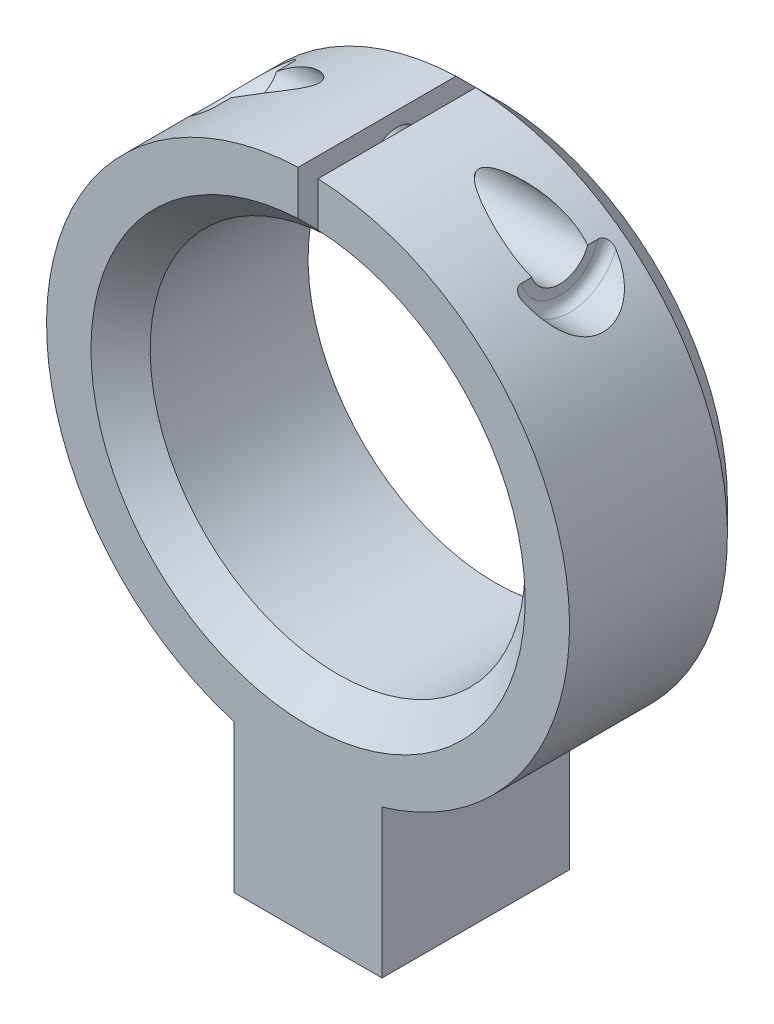
from build123d import *

# Parameters (mm, degrees)
BOSS_EXTRUDE1_DEPTH     = 16
SKETCH2_R               = 3.05
CUT_EXTRUDE1_DEPTH      = 15
BOSS_EXTRUDE2_DEPTH     = 3
CHAMFER4_SIZE           = 3
CUT_EXTRUDE2_DEPTH      = 29
CUT_EXTRUDE2_DEPTH_BACK = 25
SKETCH4_R               = 1.5
SKETCH5_R               = 2.5
CUT_EXTRUDE3_DEPTH      = 27.5
SKETCH6_R               = 3
CUT_EXTRUDE4_DEPTH      = 22.5
SKETCH5_3_R             = 5
SKETCH5_3_R_2           = 2.5
CUT_EXTRUDE5_DEPTH      = 11
SKETCH6_3_R             = 5
SKETCH6_3_R_2           = 3
CUT_EXTRUDE6_DEPTH      = 11
FILLET1_R               = 1


with BuildPart() as part:
    # Sketch1 → Boss-Extrude1 (new body)
    with BuildSketch(Plane.XY):
        with BuildLine():
            ThreePointArc((-14.719179189, 28.233250262), (-15.719179189, -9.740415699), (-16.719179189, 28.233250262))
            Line((-16.719179189, 28.233250262), (-16.719179189, 35.740709655))
            ThreePointArc((-16.719179189, 35.740709655), (-42.013744392, 12.552886715), (-23.219179189, -16.156945753))
            Line((-23.219179189, -16.156945753), (-23.219179189, -31.156945753))
            Line((-23.219179189, -31.156945753), (-8.219179189, -31.156945753))
            Line((-8.219179189, -31.156945753), (-8.219179189, -16.156945753))
            ThreePointArc((-8.219179189, -16.156945753), (10.575386014, 12.552886715), (-14.719179189, 35.740709655))
            Line((-14.719179189, 35.740709655), (-14.719179189, 28.233250262))
        make_face()
    extrude(amount=BOSS_EXTRUDE1_DEPTH)

    # Sketch2 → Cut-Extrude1 (cut)
    with BuildSketch(Plane.XZ.offset(31.156945753)):
        with Locations(Location((-15.719179189, 8.5, 0), (0, 0, 270))):
            Circle(SKETCH2_R)
    extrude(amount=-CUT_EXTRUDE1_DEPTH, mode=Mode.SUBTRACT)

    # Sketch3 → Boss-Extrude2 (add)
    with BuildSketch(Plane.XY.offset(16)):
        with BuildLine():
            ThreePointArc((-14.719179189, 28.233250262), (-15.719179189, -9.740415699), (-16.719179189, 28.233250262))
            Line((-16.719179189, 28.233250262), (-16.719179189, 35.740709655))
            ThreePointArc((-16.719179189, 35.740709655), (-42.013744392, 12.552886715), (-23.219179189, -16.156945753))
            Line((-23.219179189, -16.156945753), (-23.219179189, -31.156945753))
            Line((-23.219179189, -31.156945753), (-8.219179189, -31.156945753))
            Line((-8.219179189, -31.156945753), (-8.219179189, -16.156945753))
            ThreePointArc((-8.219179189, -16.156945753), (10.575386014, 12.552886715), (-14.719179189, 35.740709655))
            Line((-14.719179189, 35.740709655), (-14.719179189, 28.233250262))
        make_face()
    extrude(amount=BOSS_EXTRUDE2_DEPTH)

    # Chamfer4
    chamfer4_edges = [part.edges().sort_by_distance(p)[0] for p in [
        (-15.719179189, -9.740415699, 19),
        (10.575386014, 12.552886715, 0),
        (-42.013744392, 12.552886715, 0),
    ]]
    chamfer(chamfer4_edges, length=CHAMFER4_SIZE)

    # Sketch4 → Cut-Extrude2 (cut, two sides: drawn at the far end of the back side and taken through both)
    with BuildSketch(Plane.ZY.offset(14.719179189).offset(-CUT_EXTRUDE2_DEPTH_BACK)):
        with Locations(Location((9, 31.740709655, 0), (0, 0, 180))):
            Circle(SKETCH4_R)
    extrude(amount=CUT_EXTRUDE2_DEPTH + CUT_EXTRUDE2_DEPTH_BACK, mode=Mode.SUBTRACT)

    # Sketch5 → Cut-Extrude3 (cut)
    with BuildSketch(Plane.ZY.offset(42.219179189)):
        with Locations((9, 31.740709655)):
            Circle(SKETCH5_R)
    extrude(amount=-CUT_EXTRUDE3_DEPTH, mode=Mode.SUBTRACT)

    # Sketch6 → Cut-Extrude4 (cut)
    with BuildSketch(Plane(origin=(10.780820811, 0, 0), x_dir=(0, 0, -1), z_dir=(1, 0, 0))):
        with Locations((-9, 31.740709655)):
            Circle(SKETCH6_R)
    extrude(amount=-CUT_EXTRUDE4_DEPTH, mode=Mode.SUBTRACT)

    # Sketch5<3> → Cut-Extrude5 (cut)
    with BuildSketch(Plane.ZY.offset(42.219179189)):
        with Locations((9, 31.740709655)):
            Circle(SKETCH5_3_R)
        with Locations(Location((9, 31.740709655, 0), (0, 0, 336.747995985))):
            Circle(SKETCH5_3_R_2, mode=Mode.SUBTRACT)
    extrude(amount=-CUT_EXTRUDE5_DEPTH, mode=Mode.SUBTRACT)

    # Sketch6<3> → Cut-Extrude6 (cut)
    with BuildSketch(Plane(origin=(10.780820811, 0, 0), x_dir=(0, 0, -1), z_dir=(1, 0, 0))):
        with Locations((-9, 31.740709655)):
            Circle(SKETCH6_3_R)
        with Locations(Location((-9, 31.740709655, 0), (0, 0, 340.793122324))):
            Circle(SKETCH6_3_R_2, mode=Mode.SUBTRACT)
    extrude(amount=-CUT_EXTRUDE6_DEPTH, mode=Mode.SUBTRACT)

    # Fillet1
    fillet1_edges = [part.edges().sort_by_distance(p)[0] for p in [
        (-31.219179189, 26.740709655, 9),
        (-0.219179189, 26.740709655, 9),
    ]]
    fillet(fillet1_edges, radius=FILLET1_R)


solid = part.part
